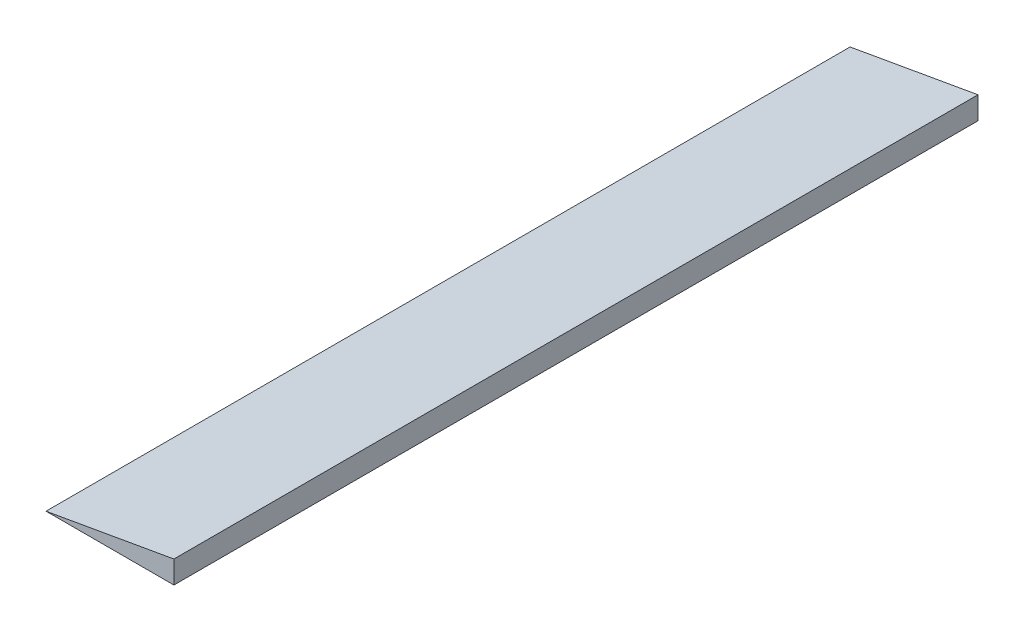
from build123d import *

# Parameters (mm, degrees)
BOSS_EXTRUDE1_DEPTH = 279.4


with BuildPart() as part:
    # Sketch1 → Boss-Extrude1 (new, symmetric)
    with BuildSketch(Plane.XY):
        Polygon((0, 0), (88.9, 0), (88.9, 15.675468585), align=None)
    extrude(amount=BOSS_EXTRUDE1_DEPTH, both=True)


solid = part.part
